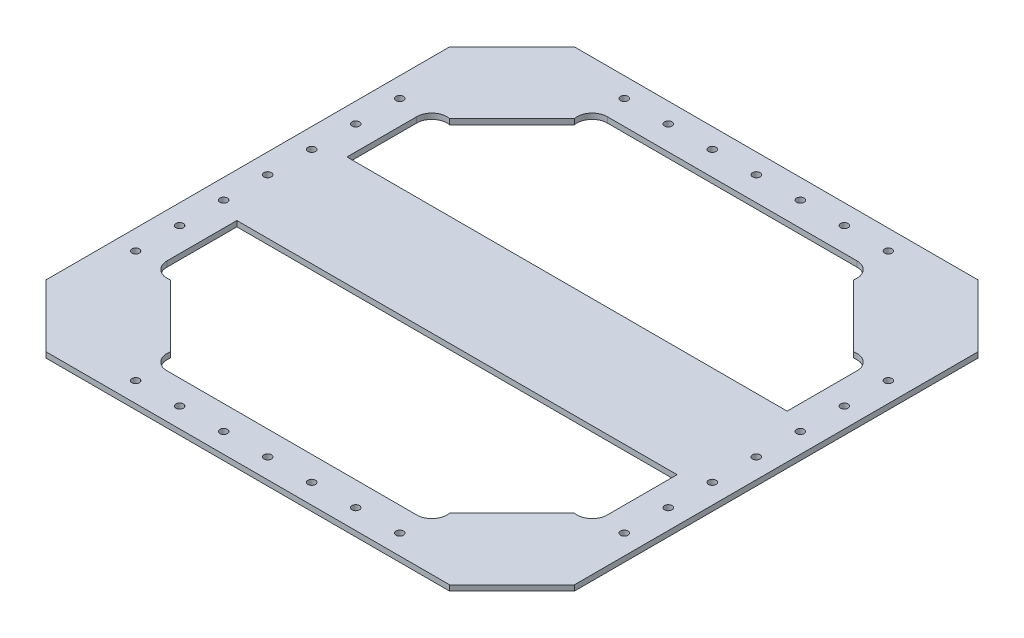
from build123d import *

# Parameters (mm, degrees)
BOSS_EXTRUDE1_DEPTH = 3.175
CUT_EXTRUDE1_DEPTH  = 252.960239461
BOSS_EXTRUDE2_DEPTH = 3.175
SKETCH4_R           = 2.159
CUT_EXTRUDE2_DEPTH  = 252.960239461


with BuildPart() as part:
    # Sketch1 → Boss-Extrude1 (new body)
    with BuildSketch(Plane(origin=(0, 0, 0), x_dir=(1, 0, 0), z_dir=(0, 1, 0))):
        Polygon((-152.4, 68.259630377), (-116.478975516, 104.180654861), (116.478975516, 104.180654861), (152.4, 68.259630377), (152.4, -164.698320655), (116.478975516, -200.619345139), (-116.478975516, -200.619345139), (-152.4, -164.698320655), align=None)
    extrude(amount=BOSS_EXTRUDE1_DEPTH)

    # Sketch2 → Cut-Extrude1 (cut, through all)
    with BuildSketch(Plane(origin=(0, 3.175, 0), x_dir=(1, 0, 0), z_dir=(0, 1, 0))):
        Polygon((-91.078975516, 78.780654861), (91.078975516, 78.780654861), (127, 42.859630377), (127, -16.469345139), (82.442975516, -16.469345139), (-74.314975516, -16.469345139), (-127, -16.469345139), (-127, 42.859630377), align=None)
        Polygon((127, -139.298320655), (91.078975516, -175.219345139), (-91.078975516, -175.219345139), (-127, -139.298320655), (-127, -79.969345139), (-74.314975516, -79.969345139), (82.442975516, -79.969345139), (127, -79.969345139), align=None)
    extrude(amount=-CUT_EXTRUDE1_DEPTH, mode=Mode.SUBTRACT)

    # Sketch5 → Boss-Extrude2 (add)
    with BuildSketch(Plane(origin=(0, 3.175, 0), x_dir=(1, 0, 0), z_dir=(0, 1, 0))):
        with BuildLine():
            Line((-116.478975516, 32.338605892), (-80.557951031, 68.259630377))
            ThreePointArc((-80.557951031, 68.259630377), (-78.800891411, 75.552814743), (-72.028975516, 78.780654861))
            Line((-72.028975516, 78.780654861), (-59.328975516, 78.780654861))
            Line((-59.328975516, 78.780654861), (-59.328975516, 104.180654861))
            Line((-59.328975516, 104.180654861), (-116.478975516, 104.180654861))
            Line((-116.478975516, 104.180654861), (-152.4, 68.259630377))
            Line((-152.4, 68.259630377), (-152.4, 11.109630377))
            Line((-152.4, 11.109630377), (-127, 11.109630377))
            Line((-127, 11.109630377), (-127, 23.809630377))
            ThreePointArc((-127, 23.809630377), (-123.772159882, 30.581546271), (-116.478975516, 32.338605892))
        make_face()
        with BuildLine():
            Line((127, 11.109630377), (127, 23.809630377))
            ThreePointArc((127, 23.809630377), (123.772159882, 30.581546271), (116.478975516, 32.338605892))
            Line((116.478975516, 32.338605892), (80.557951031, 68.259630377))
            ThreePointArc((80.557951031, 68.259630377), (78.800891411, 75.552814743), (72.028975516, 78.780654861))
            Line((72.028975516, 78.780654861), (59.328975516, 78.780654861))
            Line((59.328975516, 78.780654861), (59.328975516, 104.180654861))
            Line((59.328975516, 104.180654861), (116.478975516, 104.180654861))
            Line((116.478975516, 104.180654861), (152.4, 68.259630377))
            Line((152.4, 68.259630377), (152.4, 11.109630377))
            Line((152.4, 11.109630377), (127, 11.109630377))
        make_face()
        with BuildLine():
            Line((116.478975516, -128.777296171), (80.557951031, -164.698320655))
            ThreePointArc((80.557951031, -164.698320655), (78.800891411, -171.991505021), (72.028975516, -175.219345139))
            Line((72.028975516, -175.219345139), (59.328975516, -175.219345139))
            Line((59.328975516, -175.219345139), (59.328975516, -200.619345139))
            Line((59.328975516, -200.619345139), (116.478975516, -200.619345139))
            Line((116.478975516, -200.619345139), (152.4, -164.698320655))
            Line((152.4, -164.698320655), (152.4, -107.548320655))
            Line((152.4, -107.548320655), (127, -107.548320655))
            Line((127, -107.548320655), (127, -120.248320655))
            ThreePointArc((127, -120.248320655), (123.772159882, -127.02023655), (116.478975516, -128.777296171))
        make_face()
        with BuildLine():
            Line((-127, -107.548320655), (-127, -120.248320655))
            ThreePointArc((-127, -120.248320655), (-123.772159882, -127.02023655), (-116.478975516, -128.777296171))
            Line((-116.478975516, -128.777296171), (-80.557951031, -164.698320655))
            ThreePointArc((-80.557951031, -164.698320655), (-78.800891411, -171.991505021), (-72.028975516, -175.219345139))
            Line((-72.028975516, -175.219345139), (-59.328975516, -175.219345139))
            Line((-59.328975516, -175.219345139), (-59.328975516, -200.619345139))
            Line((-59.328975516, -200.619345139), (-116.478975516, -200.619345139))
            Line((-116.478975516, -200.619345139), (-152.4, -164.698320655))
            Line((-152.4, -164.698320655), (-152.4, -107.548320655))
            Line((-152.4, -107.548320655), (-127, -107.548320655))
        make_face()
    extrude(amount=-BOSS_EXTRUDE2_DEPTH)

    # Sketch4 → Cut-Extrude2 (cut, through all)
    with BuildSketch(Plane(origin=(0, 3.175, 0), x_dir=(1, 0, 0), z_dir=(0, 1, 0))):
        with Locations(Location((0, 92.750654861, 0), (0, 0, 270))):
            Circle(SKETCH4_R)
        with Locations(Location((-50.8, 92.750654861, 0), (0, 0, 270))):
            Circle(SKETCH4_R)
        with Locations(Location((50.8, 92.750654861, 0), (0, 0, 270))):
            Circle(SKETCH4_R)
        with Locations(Location((-25.4, 92.750654861, 0), (0, 0, 270))):
            Circle(SKETCH4_R)
        with Locations(Location((25.4, 92.750654861, 0), (0, 0, 270))):
            Circle(SKETCH4_R)
        with Locations(Location((-140.97, -48.219345139, 0), (0, 0, 270))):
            Circle(SKETCH4_R)
        with Locations(Location((-140.97, -22.819345139, 0), (0, 0, 270))):
            Circle(SKETCH4_R)
        with Locations(Location((-140.97, 2.580654861, 0), (0, 0, 270))):
            Circle(SKETCH4_R)
        with Locations(Location((140.97, -48.219345139, 0), (0, 0, 270))):
            Circle(SKETCH4_R)
        with Locations(Location((140.97, -22.819345139, 0), (0, 0, 270))):
            Circle(SKETCH4_R)
        with Locations(Location((140.97, 2.580654861, 0), (0, 0, 270))):
            Circle(SKETCH4_R)
        with Locations(Location((140.97, -99.019345139, 0), (0, 0, 90))):
            Circle(SKETCH4_R)
        with Locations(Location((140.97, -73.619345139, 0), (0, 0, 90))):
            Circle(SKETCH4_R)
        with Locations(Location((-140.97, -99.019345139, 0), (0, 0, 90))):
            Circle(SKETCH4_R)
        with Locations(Location((-140.97, -73.619345139, 0), (0, 0, 90))):
            Circle(SKETCH4_R)
        with Locations(Location((25.4, -189.189345139, 0), (0, 0, 90))):
            Circle(SKETCH4_R)
        with Locations(Location((-25.4, -189.189345139, 0), (0, 0, 90))):
            Circle(SKETCH4_R)
        with Locations(Location((50.8, -189.189345139, 0), (0, 0, 90))):
            Circle(SKETCH4_R)
        with Locations(Location((-50.8, -189.189345139, 0), (0, 0, 90))):
            Circle(SKETCH4_R)
        with Locations(Location((0, -189.189345139, 0), (0, 0, 90))):
            Circle(SKETCH4_R)
        with Locations(Location((-76.2, 92.750654861, 0), (0, 0, 270))):
            Circle(SKETCH4_R)
        with Locations(Location((76.2, 92.750654861, 0), (0, 0, 270))):
            Circle(SKETCH4_R)
        with Locations(Location((-140.97, 27.980654861, 0), (0, 0, 270))):
            Circle(SKETCH4_R)
        with Locations(Location((140.97, 27.980654861, 0), (0, 0, 270))):
            Circle(SKETCH4_R)
        with Locations(Location((140.97, -124.419345139, 0), (0, 0, 90))):
            Circle(SKETCH4_R)
        with Locations(Location((76.2, -189.189345139, 0), (0, 0, 90))):
            Circle(SKETCH4_R)
        with Locations(Location((-76.2, -189.189345139, 0), (0, 0, 90))):
            Circle(SKETCH4_R)
        with Locations(Location((-140.97, -124.419345139, 0), (0, 0, 90))):
            Circle(SKETCH4_R)
    extrude(amount=-CUT_EXTRUDE2_DEPTH, mode=Mode.SUBTRACT)


solid = part.part
